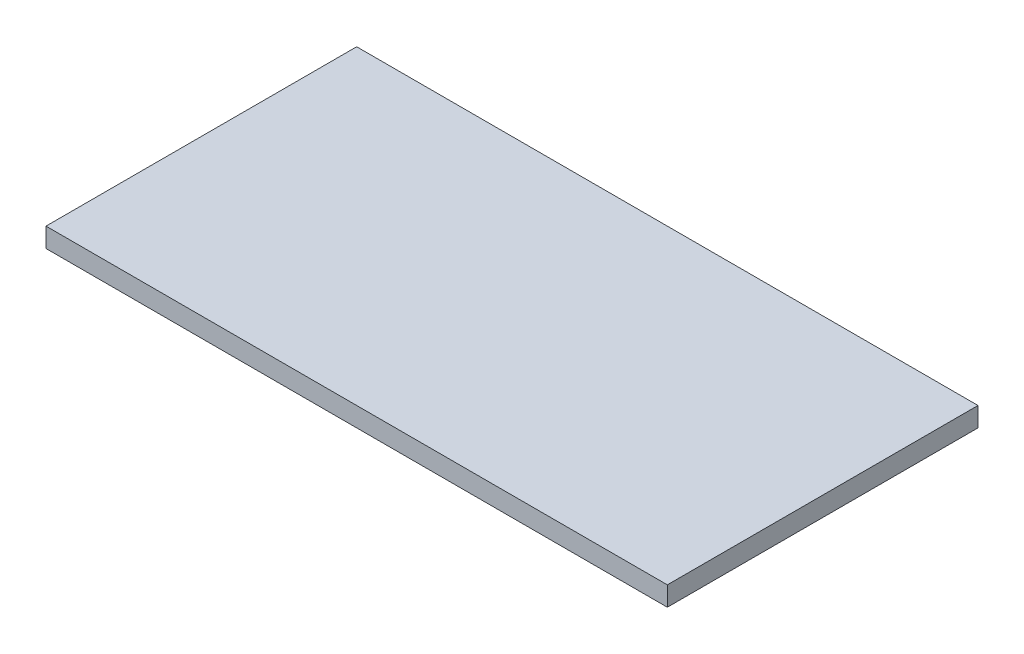
from build123d import *

# Parameters (mm, degrees)
SKETCH1_W           = 101.6
SKETCH1_H           = 50.8
BOSS_EXTRUDE1_DEPTH = 3.175


with BuildPart() as part:
    # Sketch1 → Boss-Extrude1 (new body)
    with BuildSketch(Plane(origin=(0, 0, 0), x_dir=(1, 0, 0), z_dir=(0, 1, 0))):
        Rectangle(SKETCH1_W, SKETCH1_H)
    extrude(amount=BOSS_EXTRUDE1_DEPTH)


solid = part.part
